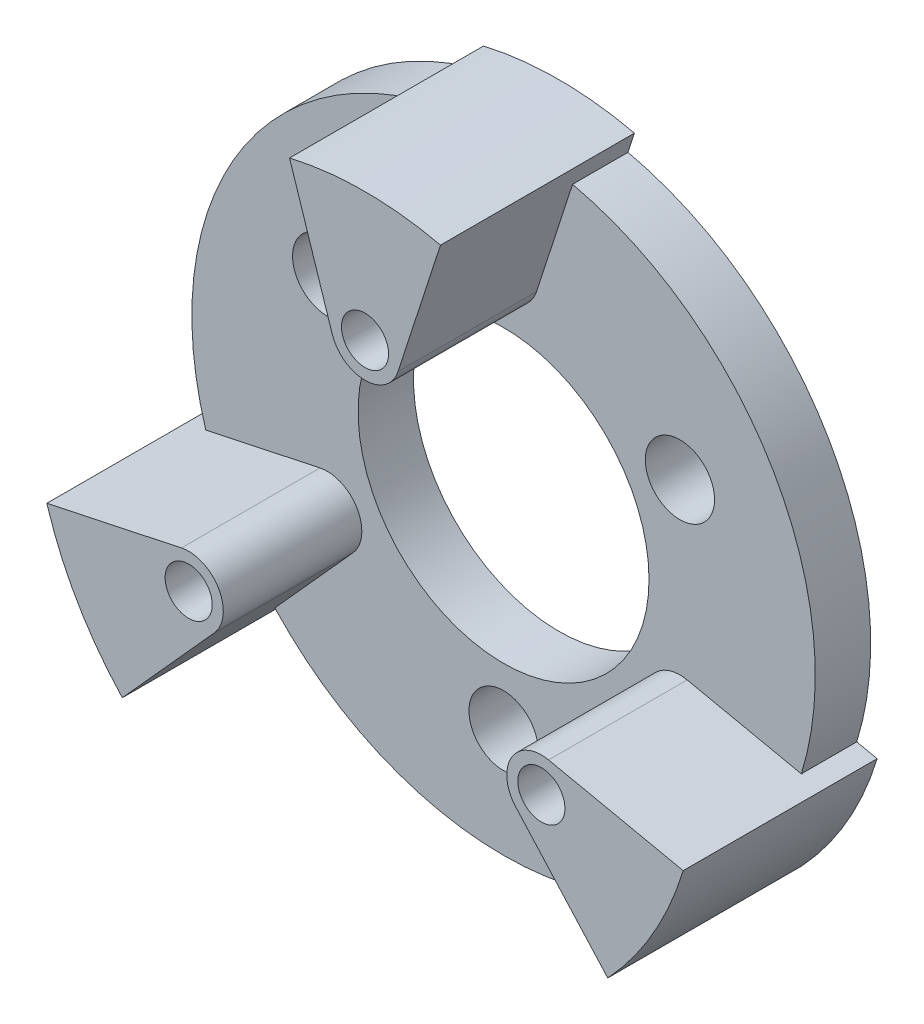
from build123d import *

# Parameters (mm, degrees)
SKETCH1_R                                       = 22.5
SKETCH1_R_2                                     = 10.5
SKETCH1_R_3                                     = 1.5
BOSS_EXTRUDE1_DEPTH                             = 4
BOSS_EXTRUDE4_START                             = -4
SKETCH4_R                                       = 2.5
SKETCH4_R_2                                     = 1.5
BOSS_EXTRUDE4_DEPTH                             = 4
SKETCH4_5_R                                     = 1.5
BOSS_EXTRUDE5_DEPTH                             = 10
CUT_EXTRUDE1_DEPTH                              = 35.690393407
CUT_EXTRUDE1_DEPTH_BACK                         = 35.690393407
SKETCH4_3_R                                     = 2.5
CSK_FOR_M3_FLAT_HEAD_MACHINE_SCREW1_D           = 3.4
CSK_FOR_M3_FLAT_HEAD_MACHINE_SCREW1_CSINK_D     = 6.3
CSK_FOR_M3_FLAT_HEAD_MACHINE_SCREW1_CSINK_ANGLE = 90


with BuildPart() as part:
    # Sketch1 → Boss-Extrude1 (new body)
    with BuildSketch(Plane.XY):
        Circle(SKETCH1_R)
        Circle(SKETCH1_R_2, mode=Mode.SUBTRACT)
        with Locations((12.730573436, -7.35)):
            Circle(SKETCH1_R_3, mode=Mode.SUBTRACT)
        with Locations((0, 14.7)):
            Circle(SKETCH1_R_3, mode=Mode.SUBTRACT)
        with Locations((-12.730573436, -7.35)):
            Circle(SKETCH1_R_3, mode=Mode.SUBTRACT)
    extrude(amount=BOSS_EXTRUDE1_DEPTH)

    # Sketch4 → Boss-Extrude4 (add)
    # profile 1 of 6: a face of its own
    with BuildSketch(Plane.XY.offset(4).offset(BOSS_EXTRUDE4_START)):
        with Locations((0, -14.7)):
            Circle(SKETCH4_R)
    # profile 2 of 6: a face of its own
    with BuildSketch(Plane.XY.offset(4).offset(BOSS_EXTRUDE4_START)):
        with Locations((-12.730573436, 7.35)):
            Circle(SKETCH4_R)
    # profile 3 of 6: a face of its own
    with BuildSketch(Plane.XY.offset(4).offset(BOSS_EXTRUDE4_START)):
        with Locations((12.730573436, 7.35)):
            Circle(SKETCH4_R)
    # profile 4 of 6: a face of its own
    with BuildSketch(Plane.XY.offset(4).offset(BOSS_EXTRUDE4_START)):
        with BuildLine():
            Line((-10.872711372, -9.022826516), (-17.518780447, -16.404034005))
            ThreePointArc((-17.518780447, -16.404034005), (-20.784609691, -12), (-22.965700397, -6.969691908))
            Line((-22.965700397, -6.969691908), (-13.250352663, -4.904630998))
            ThreePointArc((-13.250352663, -4.904630998), (-10.565509926, -6.1), (-10.872711372, -9.022826516))
        make_face()
        with Locations((-12.730573436, -7.35)):
            Circle(SKETCH4_R_2, mode=Mode.SUBTRACT)
    # profile 5 of 6: a face of its own
    with BuildSketch(Plane.XY.offset(4).offset(BOSS_EXTRUDE4_START)):
        with BuildLine():
            Line((2.377641291, 13.927457514), (5.44691995, 23.373725913))
            ThreePointArc((5.44691995, 23.373725913), (0, 24), (-5.44691995, 23.373725913))
            Line((-5.44691995, 23.373725913), (-2.377641291, 13.927457514))
            ThreePointArc((-2.377641291, 13.927457514), (0, 12.2), (2.377641291, 13.927457514))
        make_face()
        with Locations((0, 14.7)):
            Circle(SKETCH4_R_2, mode=Mode.SUBTRACT)
    # profile 6 of 6: a face of its own
    with BuildSketch(Plane.XY.offset(4).offset(BOSS_EXTRUDE4_START)):
        with BuildLine():
            Line((10.872711372, -9.022826516), (17.518780447, -16.404034005))
            ThreePointArc((17.518780447, -16.404034005), (20.784609691, -12), (22.965700397, -6.969691908))
            Line((22.965700397, -6.969691908), (13.250352663, -4.904630998))
            ThreePointArc((13.250352663, -4.904630998), (10.565509926, -6.1), (10.872711372, -9.022826516))
        make_face()
        with Locations((12.730573436, -7.35)):
            Circle(SKETCH4_R_2, mode=Mode.SUBTRACT)
    extrude(amount=BOSS_EXTRUDE4_DEPTH)

    # Sketch4<5> → Boss-Extrude5 (add)
    # profile 1 of 6: a face of its own
    with BuildSketch(Plane.XY.offset(4)):
        with BuildLine():
            Line((-5.44691995, 23.373725913), (-4.981593415, 21.941598097))
            ThreePointArc((-4.981593415, 21.941598097), (0, 22.5), (4.981593415, 21.941598097))
            Line((4.981593415, 21.941598097), (5.44691995, 23.373725913))
            ThreePointArc((5.44691995, 23.373725913), (0, 24), (-5.44691995, 23.373725913))
        make_face()
    # profile 2 of 6: a face of its own
    with BuildSketch(Plane.XY.offset(4)):
        with BuildLine():
            ThreePointArc((4.981593415, 21.941598097), (0, 22.5), (-4.981593415, 21.941598097))
            Line((-4.981593415, 21.941598097), (-2.377641291, 13.927457514))
            ThreePointArc((-2.377641291, 13.927457514), (0, 12.2), (2.377641291, 13.927457514))
            Line((2.377641291, 13.927457514), (4.981593415, 21.941598097))
        make_face()
        with Locations((0, 14.7)):
            Circle(SKETCH4_5_R, mode=Mode.SUBTRACT)
    # profile 3 of 6: a face of its own
    with BuildSketch(Plane.XY.offset(4)):
        with BuildLine():
            Line((-17.518780447, -16.404034005), (-16.511184644, -15.284985497))
            ThreePointArc((-16.511184644, -15.284985497), (-19.485571585, -11.25), (-21.492778059, -6.6566126))
            Line((-21.492778059, -6.6566126), (-22.965700397, -6.969691908))
            ThreePointArc((-22.965700397, -6.969691908), (-20.784609691, -12), (-17.518780447, -16.404034005))
        make_face()
    # profile 4 of 6: a face of its own
    with BuildSketch(Plane.XY.offset(4)):
        with BuildLine():
            Line((-16.511184644, -15.284985497), (-10.872711372, -9.022826516))
            ThreePointArc((-10.872711372, -9.022826516), (-10.565509926, -6.1), (-13.250352663, -4.904630998))
            Line((-13.250352663, -4.904630998), (-21.492778059, -6.6566126))
            ThreePointArc((-21.492778059, -6.6566126), (-19.485571585, -11.25), (-16.511184644, -15.284985497))
        make_face()
        with Locations((-12.730573436, -7.35)):
            Circle(SKETCH4_5_R, mode=Mode.SUBTRACT)
    # profile 5 of 6: a face of its own
    with BuildSketch(Plane.XY.offset(4)):
        with BuildLine():
            Line((10.872711372, -9.022826516), (16.511184644, -15.284985497))
            ThreePointArc((16.511184644, -15.284985497), (19.485571585, -11.25), (21.492778059, -6.6566126))
            Line((21.492778059, -6.6566126), (13.250352663, -4.904630998))
            ThreePointArc((13.250352663, -4.904630998), (10.565509926, -6.1), (10.872711372, -9.022826516))
        make_face()
        with Locations((12.730573436, -7.35)):
            Circle(SKETCH4_5_R, mode=Mode.SUBTRACT)
    # profile 6 of 6: a face of its own
    with BuildSketch(Plane.XY.offset(4)):
        with BuildLine():
            ThreePointArc((21.492778059, -6.6566126), (19.485571585, -11.25), (16.511184644, -15.284985497))
            Line((16.511184644, -15.284985497), (17.518780447, -16.404034005))
            ThreePointArc((17.518780447, -16.404034005), (20.784609691, -12), (22.965700397, -6.969691908))
            Line((22.965700397, -6.969691908), (21.492778059, -6.6566126))
        make_face()
    extrude(amount=BOSS_EXTRUDE5_DEPTH)

    # Sketch4<3> → Cut-Extrude1 (cut, two sides: drawn at the far end of the back side and taken through both)
    with BuildSketch(Plane.XY.offset(4).offset(-CUT_EXTRUDE1_DEPTH_BACK)):
        with Locations((0, -14.7)):
            Circle(SKETCH4_3_R)
        with Locations((-12.730573436, 7.35)):
            Circle(SKETCH4_3_R)
        with Locations((12.730573436, 7.35)):
            Circle(SKETCH4_3_R)
    extrude(amount=CUT_EXTRUDE1_DEPTH + CUT_EXTRUDE1_DEPTH_BACK, mode=Mode.SUBTRACT)

    # CSK for M3 Flat Head Machine Screw1 (through all)
    with Locations(Plane(origin=(0, 0, 0), x_dir=(-1, 0, 0), z_dir=(0, 0, -1))):
        with Locations((12.730573436, -7.35), (0, 14.7), (-12.730573436, -7.35)):
            CounterSinkHole(CSK_FOR_M3_FLAT_HEAD_MACHINE_SCREW1_D / 2, CSK_FOR_M3_FLAT_HEAD_MACHINE_SCREW1_CSINK_D / 2, counter_sink_angle=CSK_FOR_M3_FLAT_HEAD_MACHINE_SCREW1_CSINK_ANGLE)


solid = part.part
